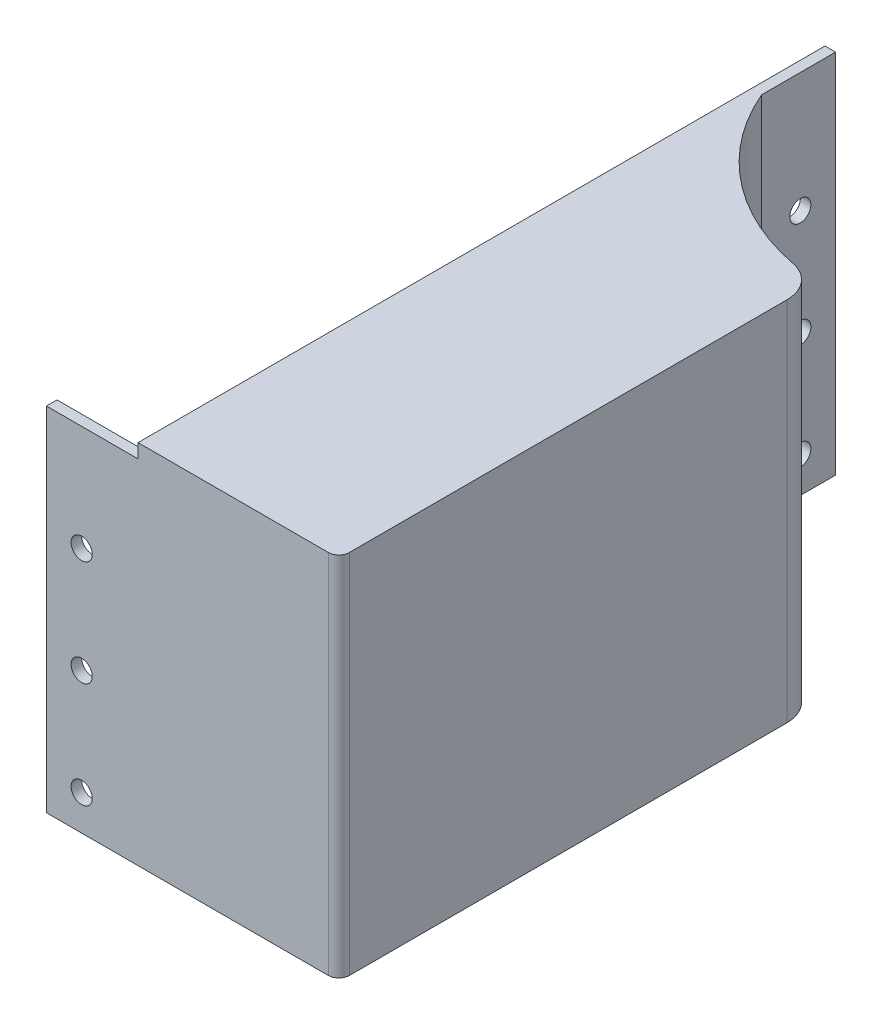
from build123d import *

# Parameters (mm, degrees)
EXTRUDE_1_DEPTH     = 100
FILLET_1_R          = 10
FILLET_2_R          = 3
SKETCH_2_R          = 3
CUT_EXTRUDE_1_DEPTH = 60
SKETCH_3_R          = 3
CUT_EXTRUDE_2_DEPTH = 60
FILLET_3_R          = 5
EXTRUDE_START       = 4
EXTRUDE_2_DEPTH     = 4


with BuildPart() as part:
    # Эскиз1 → Бобышка-Вытянуть1 (new body)
    with BuildSketch(Plane(origin=(0, 0, 0), x_dir=(1, 0, 0), z_dir=(0, 1, 0))):
        with BuildLine():
            Line((0, 152.272615506), (0, 176.272615506))
            Line((0, 176.272615506), (3, 176.272615506))
            Line((3, 176.272615506), (3, 155.272615506))
            ThreePointArc((3, 155.272615506), (24.600029492, 128.598973205), (57, 117.272615506))
            Line((57, 117.272615506), (57, -18.727384494))
            Line((57, -18.727384494), (-26, -18.727384494))
            Line((-26, -18.727384494), (-26, -15.727384494))
            Line((-26, -15.727384494), (54, -15.727384494))
            Line((54, -15.727384494), (54, 112.272615506))
            ThreePointArc((54, 112.272615506), (21.19671601, 124.438182118), (0, 152.272615506))
        make_face()
    extrude(amount=EXTRUDE_1_DEPTH)

    # Скругление1
    fillet_1_edges = [part.edges().sort_by_distance(p)[0] for p in [
        (57, 50, -117.272615506),
    ]]
    fillet(fillet_1_edges, radius=FILLET_1_R)

    # Скругление2
    fillet_2_edges = [part.edges().sort_by_distance(p)[0] for p in [
        (57, 50, 18.727384494),
    ]]
    fillet(fillet_2_edges, radius=FILLET_2_R)

    # Эскиз2 → Вырез-Вытянуть1 (cut)
    with BuildSketch(Plane.XY.offset(18.727384494)):
        with Locations((-16, 70)):
            Circle(SKETCH_2_R)
        with Locations((-16, 40)):
            Circle(SKETCH_2_R)
        with Locations((-16, 10)):
            Circle(SKETCH_2_R)
    extrude(amount=-CUT_EXTRUDE_1_DEPTH, mode=Mode.SUBTRACT)

    # Эскиз3 → Вырез-Вытянуть2 (cut)
    with BuildSketch(Plane(origin=(3, 0, 0), x_dir=(0, 0, -1), z_dir=(1, 0, 0))):
        with Locations((166.272615506, 10)):
            Circle(SKETCH_3_R)
        with Locations((166.272615506, 40)):
            Circle(SKETCH_3_R)
        with Locations((166.272615506, 70)):
            Circle(SKETCH_3_R)
    extrude(amount=-CUT_EXTRUDE_2_DEPTH, mode=Mode.SUBTRACT)

    # Скругление3
    fillet_3_edges = [part.edges().sort_by_distance(p)[0] for p in [
        (54, 50, -112.272615506),
    ]]
    fillet(fillet_3_edges, radius=FILLET_3_R)

    # Эскиз4 → Бобышка-Вытянуть2 (add)
    with BuildSketch(Plane(origin=(0, 100, 0), x_dir=(1, 0, 0), z_dir=(0, 1, 0)).offset(EXTRUDE_START)):
        with BuildLine():
            Line((3, 176.272615506), (0, 176.272615506))
            Line((0, 176.272615506), (0, -18.727384494))
            Line((0, -18.727384494), (54, -18.727384494))
            ThreePointArc((54, -18.727384494), (56.121320344, -17.848704838), (57, -15.727384494))
            Line((57, -15.727384494), (57, 108.468113504))
            ThreePointArc((57, 108.468113504), (54.709126709, 114.837522062), (48.886126924, 118.288629031))
            ThreePointArc((48.886126924, 118.288629031), (21.33303931, 131.060953474), (3, 155.272615506))
            Line((3, 155.272615506), (3, 176.272615506))
        make_face()
    extrude(amount=-EXTRUDE_2_DEPTH)


solid = part.part
